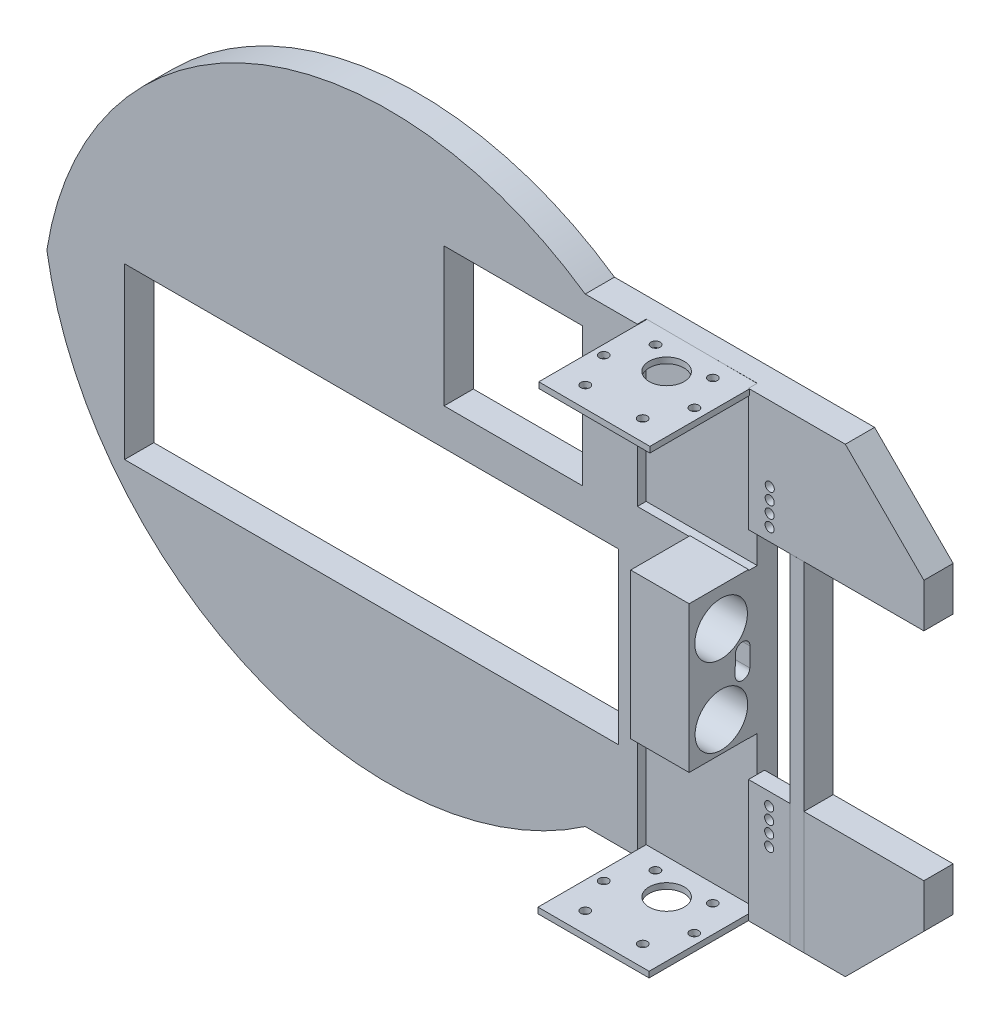
from build123d import *

# Parameters (mm, degrees)
BOSS_EXTRUDE1_DEPTH      = 10
BOSS_EXTRUDE1_DEPTH_BACK = 0.01
SKETCH3_W                = 38
SKETCH3_H                = 54
CUT_EXTRUDE1_DEPTH       = 3
SKETCH5_W                = 38
SKETCH5_H                = 54
CUT_EXTRUDE3_DEPTH       = 3
SKETCH7_W                = 169
SKETCH7_H                = 58
CUT_EXTRUDE4_DEPTH       = 261.116514656
SKETCH15_W               = 20
SKETCH15_H               = 50
BOSS_EXTRUDE3_DEPTH      = 20.3
SKETCH18_W               = 47.4
SKETCH18_H               = 47.4
CUT_EXTRUDE18_DEPTH      = 261.715344958
SKETCH21_R               = 9
CUT_EXTRUDE21_DEPTH      = 20
SKETCH28_W               = 4.75290021
SKETCH28_H               = 9.947843747
BOSS_EXTRUDE6_DEPTH      = 115.870057685
SKETCH30_W               = 14.12
SKETCH30_H               = 25
CUT_EXTRUDE25_DEPTH      = 4.5
SKETCH33_R               = 1.55
CUT_EXTRUDE26_DEPTH      = 10.01
SKETCH36_W               = 38
SKETCH36_H               = 2
BOSS_EXTRUDE7_DEPTH      = 37
SKETCH39_R               = 6
SKETCH39_R_2             = 1.55
CUT_EXTRUDE28_DEPTH      = 2
SKETCH42_R               = 6
SKETCH42_R_2             = 1.55
CUT_EXTRUDE29_DEPTH      = 2


with BuildPart() as part:
    # Sketch1 → Boss-Extrude1 (new, two sides: drawn at the far end of the back side and taken through both)
    with BuildSketch(Plane.XY.offset(-BOSS_EXTRUDE1_DEPTH_BACK)):
        with BuildLine():
            Line((0, 0), (0, -37))
            Line((0, -37), (60, -37))
            Line((60, -37), (60, -52))
            Line((60, -52), (33.129942315, -78.870057685))
            Line((33.129942315, -78.870057685), (-55.850057685, -78.870057685))
            ThreePointArc((-55.850057685, -78.870057685), (-169.614041234, -90.257166815), (-239.999947532, -0.158696229))
            ThreePointArc((-239.999947532, -0.158696229), (-169.748285548, 90.207490359), (-55.850057685, 78.870057685))
            Line((-55.850057685, 78.870057685), (33.129942315, 78.870057685))
            Line((33.129942315, 78.870057685), (60, 52))
            Line((60, 52), (60, 37))
            Line((60, 37), (0, 37))
            Line((0, 37), (0, 0))
        make_face()
    extrude(amount=BOSS_EXTRUDE1_DEPTH + BOSS_EXTRUDE1_DEPTH_BACK)

    # Sketch3 → Cut-Extrude1 (cut)
    with BuildSketch(Plane.XY.offset(10)):
        with Locations((-19, 51.870057685)):
            Rectangle(SKETCH3_W, SKETCH3_H)
    extrude(amount=-CUT_EXTRUDE1_DEPTH, mode=Mode.SUBTRACT)

    # Sketch5 → Cut-Extrude3 (cut)
    with BuildSketch(Plane.XY.offset(10)):
        with Locations((-19, -51.870057685)):
            Rectangle(SKETCH5_W, SKETCH5_H)
    extrude(amount=-CUT_EXTRUDE3_DEPTH, mode=Mode.SUBTRACT)

    # Sketch7 → Cut-Extrude4 (cut, through all)
    with BuildSketch(Plane.XY.offset(10)):
        with Locations((-128.91309413, -19.94383898)):
            Rectangle(SKETCH7_W, SKETCH7_H)
    extrude(amount=-CUT_EXTRUDE4_DEPTH, mode=Mode.SUBTRACT)

    # Sketch15 → Boss-Extrude3 (add)
    with BuildSketch(Plane.XY.offset(10)):
        with Locations((-10, 0.20156489)):
            Rectangle(SKETCH15_W, SKETCH15_H)
    extrude(amount=BOSS_EXTRUDE3_DEPTH)

    # Sketch18 → Cut-Extrude18 (cut, through all)
    with BuildSketch(Plane.XY.offset(10)):
        with Locations((-80.42454895, 45.3)):
            Rectangle(SKETCH18_W, SKETCH18_H)
    extrude(amount=-CUT_EXTRUDE18_DEPTH, mode=Mode.SUBTRACT)

    # Sketch21 → Cut-Extrude21 (cut)
    with BuildSketch(Plane(origin=(0, 0, 0), x_dir=(0, 0, -1), z_dir=(1, 0, 0))):
        with Locations((-19.36187505, 12.37175029)):
            Circle(SKETCH21_R)
        with Locations((-19.26539558, -14.62824971)):
            Circle(SKETCH21_R)
        with BuildLine():
            Line((-9.491579533, 2.276446619), (-9.557448357, -4.178698144))
            ThreePointArc((-9.557448357, -4.178698144), (-12.081396215, -6.651657156), (-14.554355227, -4.127709299))
            Line((-14.554355227, -4.127709299), (-14.488486403, 2.327435464))
            ThreePointArc((-14.488486403, 2.327435464), (-11.964538545, 4.800394476), (-9.491579533, 2.276446619))
        make_face()
    extrude(amount=-CUT_EXTRUDE21_DEPTH, mode=Mode.SUBTRACT)

    # Sketch28 → Boss-Extrude6 (add)
    with BuildSketch(Plane.XZ.offset(78.870057685)):
        with Locations((16.603067585, 5.033719824)):
            Rectangle(SKETCH28_W, SKETCH28_H)
    extrude(amount=-BOSS_EXTRUDE6_DEPTH)

    # Sketch30 → Cut-Extrude25 (cut)
    with BuildSketch(Plane(origin=(0, 0, -0.01), x_dir=(-1, 0, 0), z_dir=(0, 0, -1))):
        with Locations((-7.06, -49.5)):
            Rectangle(SKETCH30_W, SKETCH30_H)
        Polygon((-14.38072485, 61.935396467), (-14.275539526, 36.935617747), (-0.155664505, 36.995026418), (-0.260849829, 61.994805138), align=None)
    extrude(amount=-CUT_EXTRUDE25_DEPTH, mode=Mode.SUBTRACT)

    # Sketch33 → Cut-Extrude26 (cut)
    with BuildSketch(Plane(origin=(0, 0, -0.01), x_dir=(-1, 0, 0), z_dir=(0, 0, -1))):
        with Locations((-7.06, -53.4)):
            Circle(SKETCH33_R)
        with Locations((-7.06, -49.4)):
            Circle(SKETCH33_R)
        with Locations((-7.06, -45.4)):
            Circle(SKETCH33_R)
        with Locations((-7.06, -41.4)):
            Circle(SKETCH33_R)
        with Locations((-7.228632788, 41.370889137)):
            Circle(SKETCH33_R)
        with Locations((-7.244931474, 45.370855931)):
            Circle(SKETCH33_R)
        with Locations((-7.261230159, 49.370822725)):
            Circle(SKETCH33_R)
        with Locations((-7.277528845, 53.370789519)):
            Circle(SKETCH33_R)
    extrude(amount=-CUT_EXTRUDE26_DEPTH, mode=Mode.SUBTRACT)

    # Sketch36 → Boss-Extrude7 (add)
    with BuildSketch(Plane.XY.offset(7)):
        Polygon((0.279518574, 78.814629504), (0.272425555, 76.814642082), (-37.727335467, 76.949409435), (-37.720242449, 78.949396858), align=None)
        with Locations((-19, -77.815125164)):
            Rectangle(SKETCH36_W, SKETCH36_H)
    extrude(amount=BOSS_EXTRUDE7_DEPTH)

    # Sketch39 → Cut-Extrude28 (cut)
    with BuildSketch(Plane.XZ.offset(78.815125164)):
        with Locations(Location((-19, 19, 0), (0, 0, 270))):
            Circle(SKETCH39_R)
        with Locations(Location((-34.499611559, 25.01055106, 0), (0, 0, 270))):
            Circle(SKETCH39_R_2)
        with Locations(Location((-3.563871147, 24.988758691, 0), (0, 0, 270))):
            Circle(SKETCH39_R_2)
        with Locations(Location((-28.819186805, 37.01055106, 0), (0, 0, 270))):
            Circle(SKETCH39_R_2)
        with Locations(Location((-9.177448314, 36.988758691, 0), (0, 0, 270))):
            Circle(SKETCH39_R_2)
        with Locations(Location((-28.819994175, 13.01055106, 0), (0, 0, 270))):
            Circle(SKETCH39_R_2)
        with Locations(Location((-9.230494356, 12.988758691, 0), (0, 0, 270))):
            Circle(SKETCH39_R_2)
    extrude(amount=-CUT_EXTRUDE28_DEPTH, mode=Mode.SUBTRACT)

    # Sketch42 → Cut-Extrude29 (cut)
    with BuildSketch(Plane(origin=(0.279518574, 78.814629504, 0), x_dir=(0.9999937111161443, -0.003546509292438372, 0), z_dir=(0.003546509292438372, 0.9999937111161443, 0))):
        with Locations(Location((-19.279713392, -19, 0), (0, 0, 180))):
            Circle(SKETCH42_R)
        with Locations(Location((-29.070149337, -13, 0), (0, 0, 180))):
            Circle(SKETCH42_R_2)
        with Locations(Location((-3.778432466, -25, 0), (0, 0, 180))):
            Circle(SKETCH42_R_2)
        with Locations(Location((-9.464104196, -13, 0), (0, 0, 180))):
            Circle(SKETCH42_R_2)
        with Locations(Location((-34.772326096, -25, 0), (0, 0, 180))):
            Circle(SKETCH42_R_2)
        with Locations(Location((-29.096493177, -37, 0), (0, 0, 180))):
            Circle(SKETCH42_R_2)
        with Locations(Location((-9.473371075, -37, 0), (0, 0, 180))):
            Circle(SKETCH42_R_2)
    extrude(amount=-CUT_EXTRUDE29_DEPTH, mode=Mode.SUBTRACT)


solid = part.part
